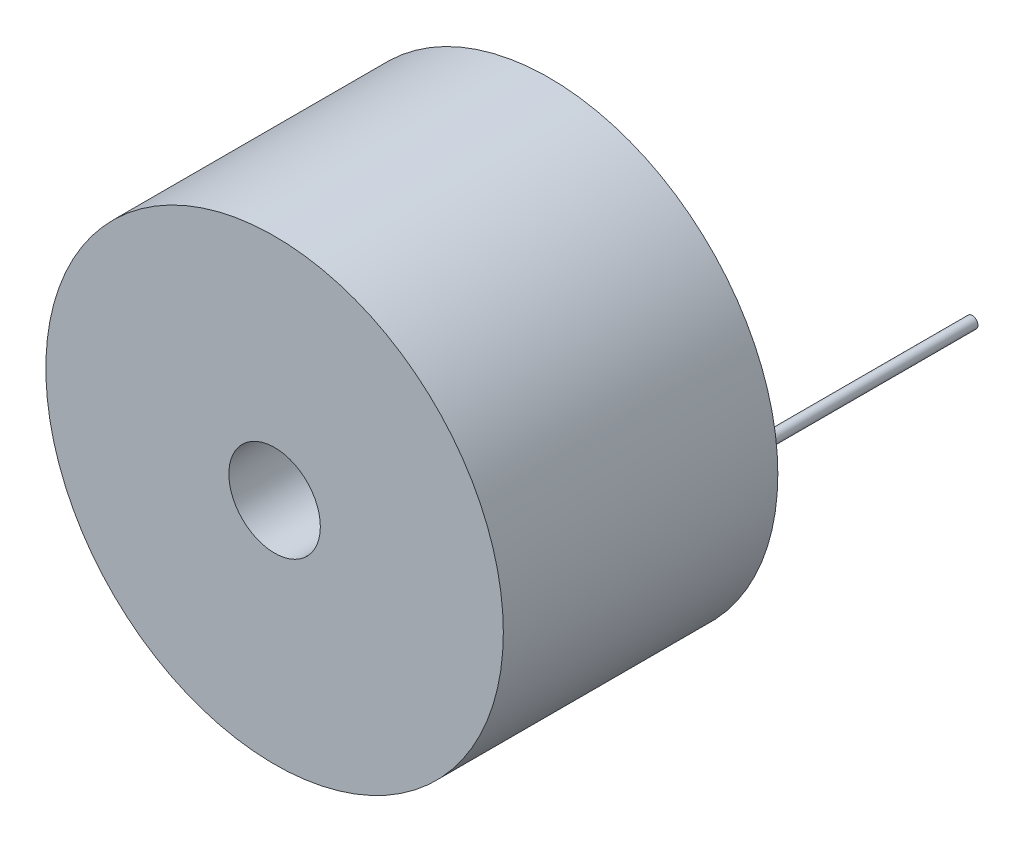
from build123d import *

# Parameters (mm, degrees)
SKETCH1_R           = 10
BOSS_EXTRUDE1_DEPTH = 12
SKETCH2_R           = 2
CUT_EXTRUDE1_DEPTH  = 10
SKETCH3_R           = 0.25
BOSS_EXTRUDE2_DEPTH = 10
SKETCH3_3_R         = 0.25
BOSS_EXTRUDE3_DEPTH = 8


with BuildPart() as part:
    # Sketch1 → Boss-Extrude1 (new body)
    with BuildSketch(Plane.XY):
        Circle(SKETCH1_R)
    extrude(amount=BOSS_EXTRUDE1_DEPTH)

    # Sketch2 → Cut-Extrude1 (cut)
    with BuildSketch(Plane.XY.offset(12)):
        Circle(SKETCH2_R)
    extrude(amount=-CUT_EXTRUDE1_DEPTH, mode=Mode.SUBTRACT)

    # Sketch3 → Boss-Extrude2 (add)
    with BuildSketch(Plane(origin=(0, 0, 0), x_dir=(-1, 0, 0), z_dir=(0, 0, -1))):
        with Locations((-8.5, 0)):
            Circle(SKETCH3_R)
    extrude(amount=BOSS_EXTRUDE2_DEPTH)

    # Sketch3<3> → Boss-Extrude3 (add)
    with BuildSketch(Plane(origin=(0, 0, 0), x_dir=(-1, 0, 0), z_dir=(0, 0, -1))):
        with Locations((8.5, 0)):
            Circle(SKETCH3_3_R)
    extrude(amount=BOSS_EXTRUDE3_DEPTH)


solid = part.part
